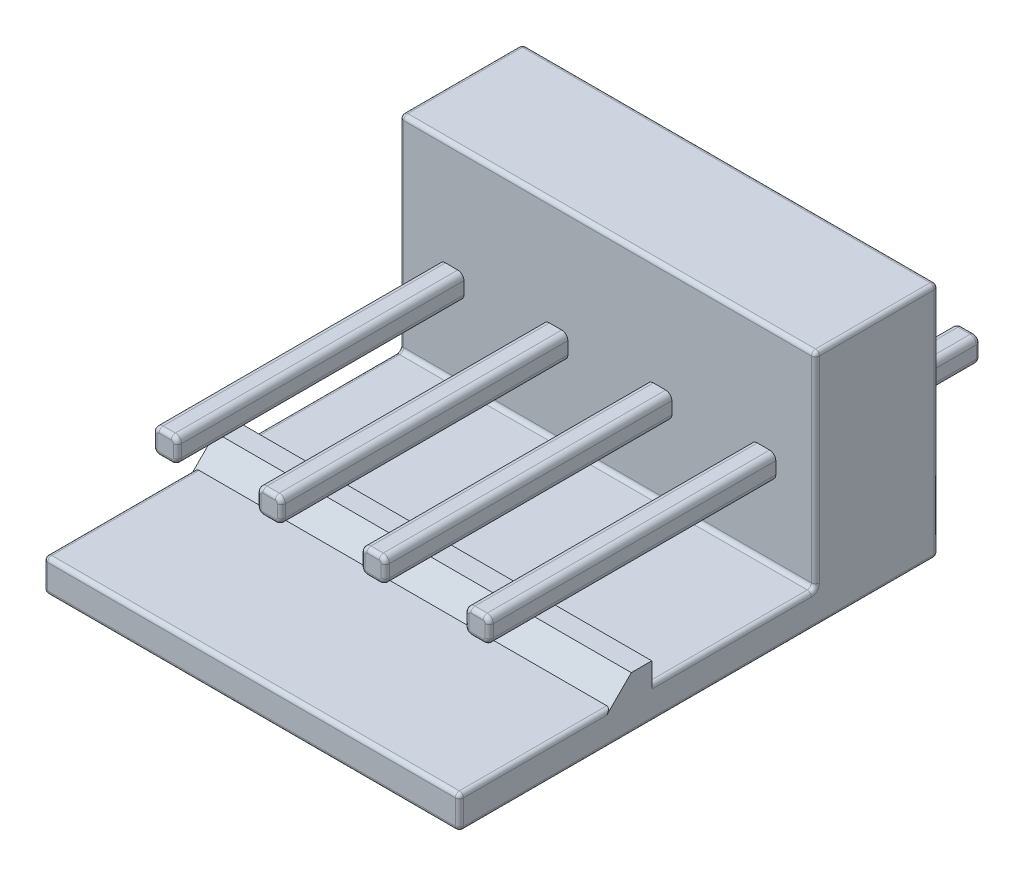
from build123d import *

# Parameters (mm, degrees)
SKETCH_1_W             = 10.16
SKETCH_1_H             = 5.8
EXTRUDE_1_DEPTH        = 11.7
CUT_EXTRUDE_1_DEPTH    = 16.764694732
EXTRUDE_START          = -10
EXTRUDE_2_DEPTH        = 12
FILLET_1_R             = 0.1
FILLET_1_OF_MIRROR_1_R = 0.1
FILLET_2_R             = 0.1


with BuildPart() as part:
    # 草图1 → 凸台-拉伸1 (new body)
    with BuildSketch(Plane.XY):
        Rectangle(SKETCH_1_W, SKETCH_1_H)
    extrude(amount=EXTRUDE_1_DEPTH)

    # 草图2 → 切除-拉伸1 (cut, through all)
    with BuildSketch(Plane(origin=(5.08, 0, 0), x_dir=(0, 0, -1), z_dir=(1, 0, 0))):
        Polygon((-11.7, -2.1), (-8, -2.1), (-7.5, -1.6), (-7, -1.6), (-7, -2.1), (-3, -2.1), (-3, 2.9), (-11.7, 2.9), align=None)
    extrude(amount=-CUT_EXTRUDE_1_DEPTH, mode=Mode.SUBTRACT)

    # 草图3 → 凸台-拉伸2 (add)
    with BuildSketch(Plane(origin=(0, 0, 0), x_dir=(-1, 0, 0), z_dir=(0, 0, -1)).offset(EXTRUDE_START)):
        with BuildLine():
            Line((-1.57, -0.15), (-1.57, 0.15))
            ThreePointArc((-1.57, 0.15), (-1.526066017, 0.256066017), (-1.42, 0.3))
            Line((-1.42, 0.3), (-1.12, 0.3))
            ThreePointArc((-1.12, 0.3), (-1.013933983, 0.256066017), (-0.97, 0.15))
            Line((-0.97, 0.15), (-0.97, -0.15))
            ThreePointArc((-0.97, -0.15), (-1.013933983, -0.256066017), (-1.12, -0.3))
            Line((-1.12, -0.3), (-1.42, -0.3))
            ThreePointArc((-1.42, -0.3), (-1.526066017, -0.256066017), (-1.57, -0.15))
        make_face()
        with BuildLine():
            Line((-4.11, -0.15), (-4.11, 0.15))
            ThreePointArc((-4.11, 0.15), (-4.066066017, 0.256066017), (-3.96, 0.3))
            Line((-3.96, 0.3), (-3.66, 0.3))
            ThreePointArc((-3.66, 0.3), (-3.553933983, 0.256066017), (-3.51, 0.15))
            Line((-3.51, 0.15), (-3.51, -0.15))
            ThreePointArc((-3.51, -0.15), (-3.553933983, -0.256066017), (-3.66, -0.3))
            Line((-3.66, -0.3), (-3.96, -0.3))
            ThreePointArc((-3.96, -0.3), (-4.066066017, -0.256066017), (-4.11, -0.15))
        make_face()
    extrude_2 = extrude(amount=EXTRUDE_2_DEPTH)

    # 圆角1
    fillet_1_edges = [part.edges().sort_by_distance(p)[0] for p in [
        (1.013933983, 0.256066017, 10),
        (0.97, 0, 10),
        (1.013933983, -0.256066017, 10),
        (1.27, -0.3, 10),
        (1.526066017, -0.256066017, 10),
        (1.57, 0, 10),
        (1.526066017, 0.256066017, 10),
        (1.27, 0.3, 10),
        (1.013933983, 0.256066017, -2),
        (1.27, 0.3, -2),
        (1.526066017, 0.256066017, -2),
        (1.57, 0, -2),
        (1.526066017, -0.256066017, -2),
        (1.27, -0.3, -2),
        (1.013933983, -0.256066017, -2),
        (0.97, 0, -2),
        (3.553933983, 0.256066017, 10),
        (3.51, 0, 10),
        (3.553933983, -0.256066017, 10),
        (3.81, -0.3, 10),
        (4.066066017, -0.256066017, 10),
        (4.11, 0, 10),
        (4.066066017, 0.256066017, 10),
        (3.81, 0.3, 10),
        (3.553933983, 0.256066017, -2),
        (3.81, 0.3, -2),
        (4.066066017, 0.256066017, -2),
        (4.11, 0, -2),
        (4.066066017, -0.256066017, -2),
        (3.81, -0.3, -2),
        (3.553933983, -0.256066017, -2),
        (3.51, 0, -2),
    ]]
    fillet(fillet_1_edges, radius=FILLET_1_R)

    # 镜向1: 凸台-拉伸2 across plane
    add(extrude_2.mirror(Plane(origin=(0, 0, 0), x_dir=(0, 0, 1), z_dir=(1, 0, 0))))

    # 圆角1 of 镜向1
    fillet_1_of_mirror_1_edges = [part.edges().sort_by_distance(p)[0] for p in [
        (-1.013933983, 0.256066017, 10),
        (-0.97, 0, 10),
        (-1.013933983, -0.256066017, 10),
        (-1.27, -0.3, 10),
        (-1.526066017, -0.256066017, 10),
        (-1.57, 0, 10),
        (-1.526066017, 0.256066017, 10),
        (-1.27, 0.3, 10),
        (-1.013933983, 0.256066017, -2),
        (-1.27, 0.3, -2),
        (-1.526066017, 0.256066017, -2),
        (-1.57, 0, -2),
        (-1.526066017, -0.256066017, -2),
        (-1.27, -0.3, -2),
        (-1.013933983, -0.256066017, -2),
        (-0.97, 0, -2),
        (-3.553933983, 0.256066017, 10),
        (-3.51, 0, 10),
        (-3.553933983, -0.256066017, 10),
        (-3.81, -0.3, 10),
        (-4.066066017, -0.256066017, 10),
        (-4.11, 0, 10),
        (-4.066066017, 0.256066017, 10),
        (-3.81, 0.3, 10),
        (-3.553933983, 0.256066017, -2),
        (-3.81, 0.3, -2),
        (-4.066066017, 0.256066017, -2),
        (-4.11, 0, -2),
        (-4.066066017, -0.256066017, -2),
        (-3.81, -0.3, -2),
        (-3.553933983, -0.256066017, -2),
        (-3.51, 0, -2),
    ]]
    fillet(fillet_1_of_mirror_1_edges, radius=FILLET_1_OF_MIRROR_1_R)

    # 圆角2
    fillet_2_edges = [part.edges().sort_by_distance(p)[0] for p in [
        (0, -2.9, 11.7),
        (-5.08, -2.5, 11.7),
        (-5.08, 2.9, 1.5),
        (5.08, 2.9, 1.5),
        (0, -2.1, 11.7),
        (-5.08, 0.4, 3),
        (0, 2.9, 3),
        (-5.08, -2.1, 5),
        (0, -2.1, 3),
        (-5.08, -2.1, 9.85),
        (5.08, -2.1, 9.85),
        (5.08, -2.1, 5),
        (5.08, 0.4, 3),
        (5.08, -2.5, 11.7),
        (0, -2.9, 0),
        (-5.08, 0, 0),
        (0, 2.9, 0),
        (5.08, 0, 0),
        (5.08, -2.9, 5.85),
        (-5.08, -2.9, 5.85),
    ]]
    fillet(fillet_2_edges, radius=FILLET_2_R)


solid = part.part
